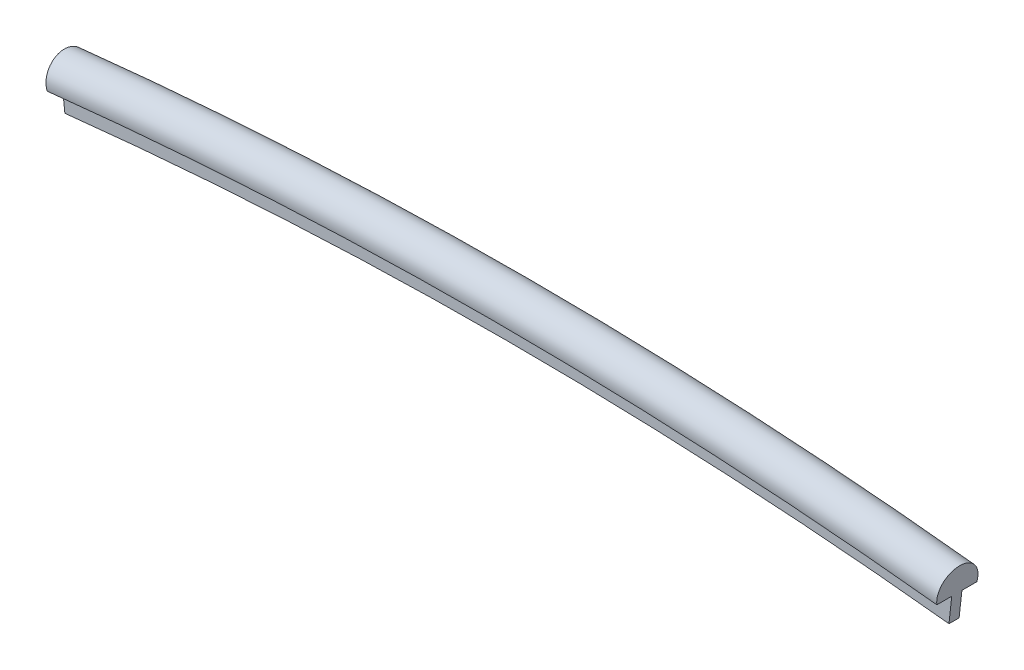
from build123d import *

# Parameters (mm, degrees)
REVOLVE1_ANGLE           = 6.256713905
REVOLVE1_OTHER_WAY_ANGLE = 6.256713905


with BuildPart() as part:
    # Sketch2 → Revolve1 (revolve)
    with BuildSketch(Plane(origin=(0, 0, 0), x_dir=(0, 0, -1), z_dir=(1, 0, 0))):
        with BuildLine():
            Line((0, 239.8), (0.3, 239.8))
            Line((0.3, 239.8), (0.3, 241.3))
            Line((0.3, 241.3), (1.18, 241.3))
            ThreePointArc((1.18, 241.3), (0, 242.800182019), (-1.18, 241.3))
            Line((-1.18, 241.3), (-0.3, 241.3))
            Line((-0.3, 241.3), (-0.3, 239.8))
            Line((-0.3, 239.8), (0, 239.8))
        make_face()
    revolve(axis=Axis((0, 0, 70.597641597), (0, 0, -1)), revolution_arc=REVOLVE1_ANGLE)

    # Sketch2 → Revolve1 other way (revolve)
    with BuildSketch(Plane(origin=(0, 0, 0), x_dir=(0, 0, -1), z_dir=(1, 0, 0))):
        with BuildLine():
            Line((0, 239.8), (0.3, 239.8))
            Line((0.3, 239.8), (0.3, 241.3))
            Line((0.3, 241.3), (1.18, 241.3))
            ThreePointArc((1.18, 241.3), (0, 242.800182019), (-1.18, 241.3))
            Line((-1.18, 241.3), (-0.3, 241.3))
            Line((-0.3, 241.3), (-0.3, 239.8))
            Line((-0.3, 239.8), (0, 239.8))
        make_face()
    revolve(axis=Axis((0, 0, 70.597641597), (0, 0, 1)), revolution_arc=REVOLVE1_OTHER_WAY_ANGLE)


solid = part.part
